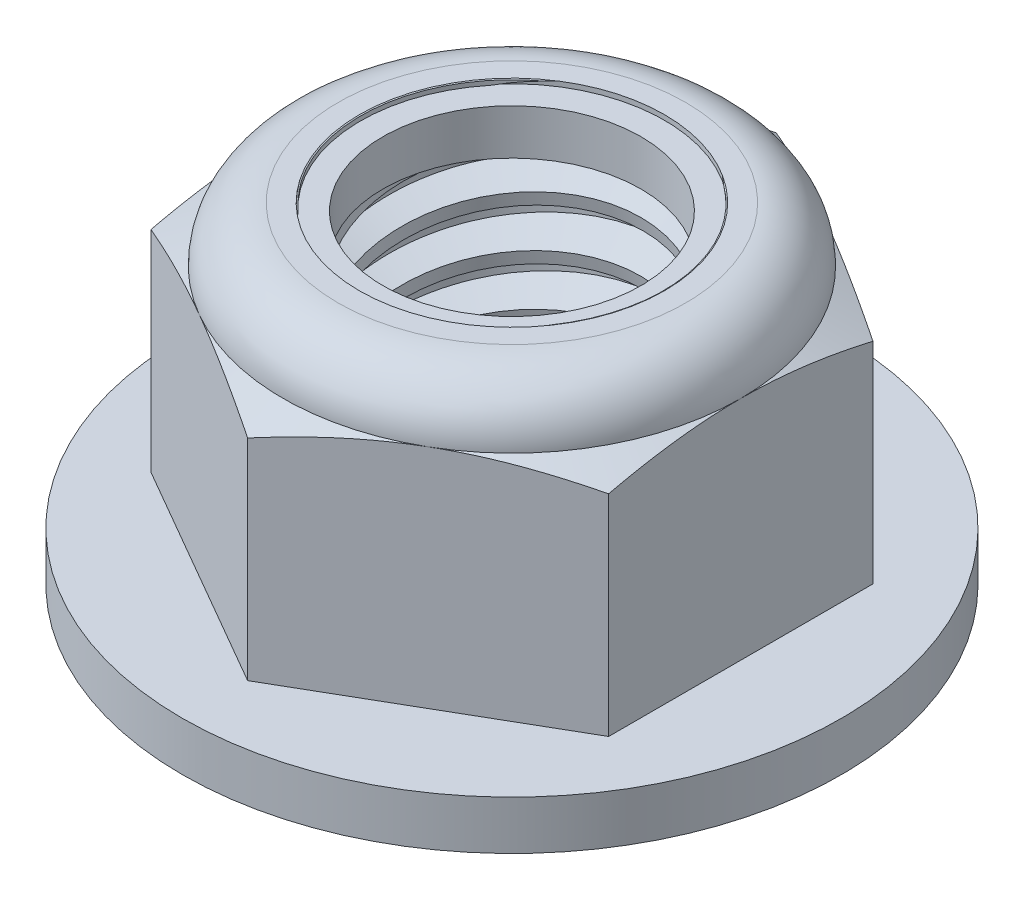
from build123d import *

# Parameters (mm, degrees)
EXTRUDE1_DEPTH      = 10.31875
SKETCH8_W           = 10.287
SKETCH8_H           = 1.524
SKETCH2_W           = 4.7625
SKETCH2_H           = 10.31875
LPATTERN1_COUNT     = 7
LPATTERN1_PITCH     = 1.5875
LPATTERN1_COL_COUNT = 2
LPATTERN1_COL_PITCH = 1.5875


with BuildPart() as part:
    # Sketch1 → Extrude1 (new body)
    with BuildSketch(Plane(origin=(0, 0, 0), x_dir=(1, 0, 0), z_dir=(0, 1, 0))):
        Polygon((0, 8.248891971), (-7.14375, 4.124445986), (-7.14375, -4.124445986), (0, -8.248891971), (7.14375, -4.124445986), (7.14375, 4.124445986), align=None)
    extrude(amount=EXTRUDE1_DEPTH)

    # Sketch8 → Revolve3 (revolve)
    with BuildSketch(Plane(origin=(0, 0, 0), x_dir=(0, 0, -1), z_dir=(1, 0, 0)), mode=Mode.PRIVATE) as revolve3_sk:
        with Locations((5.1435, 0.762)):
            Rectangle(SKETCH8_W, SKETCH8_H)
    revolve(revolve3_sk.sketch.rotate(Axis((0, 0, 0), (0, -1, 0)), 180), axis=Axis((0, 0, 0), (0, -1, 0)))

    # Sketch4 → Cut-Revolve2 (revolve, cut)
    with BuildSketch(Plane(origin=(0, 0, 0), x_dir=(0, 0, -1), z_dir=(1, 0, 0)), mode=Mode.PRIVATE) as cut_revolve2_sk:
        Polygon((0, 10.31875), (4.7625, 10.31875), (4.029111805, 9.976765468), (4.029111805, 0.341984532), (4.7625, 0), (0, 0), align=None)
    revolve(cut_revolve2_sk.sketch.rotate(Axis((0, 10.31875, 0), (0, 1, 0)), 55.157981045), axis=Axis((0, 10.31875, 0), (0, 1, 0)), mode=Mode.SUBTRACT)


with BuildPart() as body_2:
    # Sketch2 → Revolve1 (revolve)
    with BuildSketch(Plane(origin=(0, 0, 0), x_dir=(0, 0, -1), z_dir=(1, 0, 0))):
        with Locations((2.38125, 5.159375)):
            Rectangle(SKETCH2_W, SKETCH2_H)
    revolve(axis=Axis((0, -4.7625, 0), (0, 1, 0)))

    # Sketch3 → Cut-Revolve1 (revolve, cut)
    with BuildSketch(Plane(origin=(0, 0, 0), x_dir=(0, 0, -1), z_dir=(1, 0, 0)), mode=Mode.PRIVATE) as cut_revolve1_sk:
        Polygon((4.795122924, 10.123012456), (5.023483392, 8.752849646), (4.094357653, 9.100932102), (4.029111805, 9.49240719), align=None)
    cut_revolve1 = revolve(cut_revolve1_sk.sketch.rotate(Axis((0, 10.31875, 0.28317269), (0, -0.9863939238321437, -0.16439898730535754)), 180), axis=Axis((0, 10.31875, 0.28317269), (0, -0.9863939238321437, -0.16439898730535754)), mode=Mode.SUBTRACT)

    # LPattern1: Cut-Revolve1 ×7
    with Locations(*[(0, -i * LPATTERN1_PITCH, 0) for i in range(1, LPATTERN1_COUNT)]):
        add(cut_revolve1, mode=Mode.SUBTRACT)

    # LPattern1 col: Cut-Revolve1 ×2
    with Locations(*[(0, i * LPATTERN1_COL_PITCH, 0) for i in range(1, LPATTERN1_COL_COUNT)]):
        add(cut_revolve1, mode=Mode.SUBTRACT)


with BuildPart() as part_1:
    add(part.part)

    # Combine1: cut body 2
    add(body_2.part, mode=Mode.SUBTRACT)

    # Sketch5 → Cut-Revolve3 (revolve, cut)
    with BuildSketch(Plane(origin=(0, 0, 0), x_dir=(0, 0, -1), z_dir=(1, 0, 0)), mode=Mode.PRIVATE) as cut_revolve3_sk:
        with BuildLine():
            Line((8.248891971, 1.524), (8.248891971, 8.083622169))
            Line((8.248891971, 8.083622169), (7.14375, 8.598958333))
            ThreePointArc((7.14375, 8.598958333), (6.640034683, 9.815034683), (5.423958333, 10.31875))
            Line((5.423958333, 10.31875), (5.423958333, 11.58875))
            Line((5.423958333, 11.58875), (9.518891971, 11.58875))
            Line((9.518891971, 11.58875), (9.518891971, 1.524))
            Line((9.518891971, 1.524), (8.248891971, 1.524))
        make_face()
    revolve(cut_revolve3_sk.sketch.rotate(Axis((0, 0, 0), (0, 1, 0)), 55.157981045), axis=Axis((0, 0, 0), (0, 1, 0)), mode=Mode.SUBTRACT)

    # Sketch6 → Cut-Revolve4 (revolve, cut)
    with BuildSketch(Plane(origin=(0, 0, 0), x_dir=(0, 0, -1), z_dir=(1, 0, 0)), mode=Mode.PRIVATE) as cut_revolve4_sk:
        with BuildLine():
            Line((0, 8.598958333), (6.99135, 8.598958333))
            ThreePointArc((6.99135, 8.598958333), (6.53227161, 9.70727161), (5.423958333, 10.16635))
            Line((5.423958333, 10.16635), (4.726535069, 10.16635))
            Line((4.726535069, 10.16635), (4.726535069, 11.58875))
            Line((4.726535069, 11.58875), (0, 11.58875))
            Line((0, 11.58875), (0, 8.598958333))
        make_face()
    revolve(cut_revolve4_sk.sketch.rotate(Axis((0, 11.58875, 0), (0, 1, 0)), 55.157981045), axis=Axis((0, 11.58875, 0), (0, 1, 0)), mode=Mode.SUBTRACT)


with BuildPart() as body_2_2:
    # Sketch7 → Revolve2 (revolve)
    with BuildSketch(Plane(origin=(0, 0, 0), x_dir=(0, 0, -1), z_dir=(1, 0, 0)), mode=Mode.PRIVATE) as revolve2_sk:
        with BuildLine():
            Line((4.029111805, 8.675158333), (6.913201815, 8.675158333))
            ThreePointArc((6.913201815, 8.675158333), (6.451096051, 9.679995195), (5.423958333, 10.09015))
            Line((5.423958333, 10.09015), (4.029111805, 10.09015))
            Line((4.029111805, 10.09015), (4.029111805, 8.675158333))
        make_face()
    revolve(revolve2_sk.sketch.rotate(Axis((0, 8.675158333, 0), (0, 1, 0)), 47.227985619), axis=Axis((0, 8.675158333, 0), (0, 1, 0)))


solid = Compound([part_1.part, body_2_2.part])
